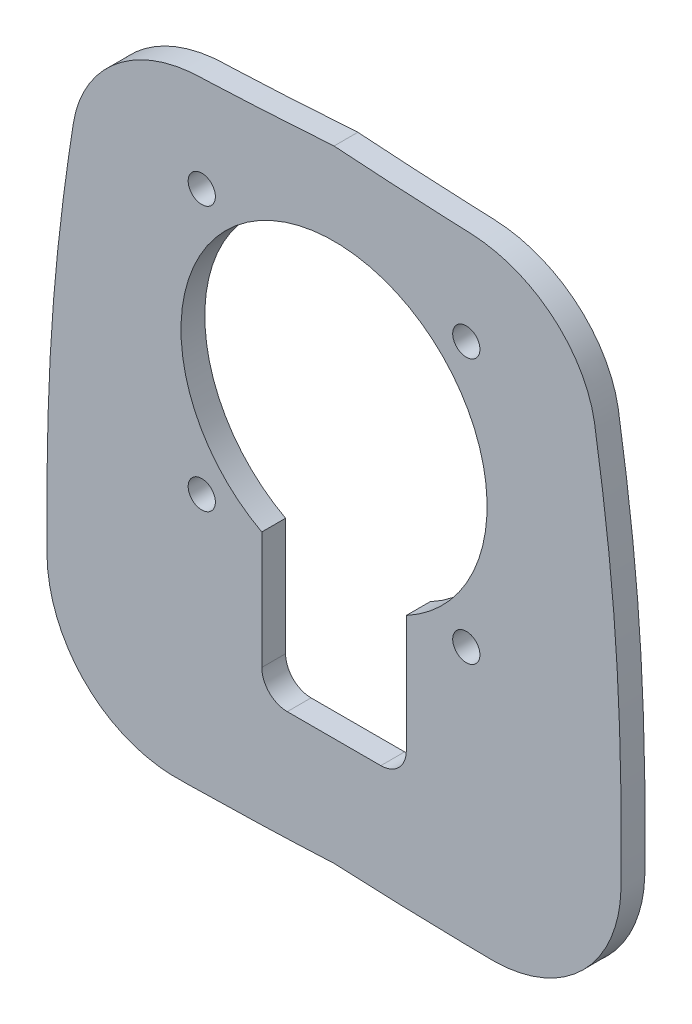
from build123d import *

# Parameters (mm, degrees)
SKETCH_1_R      = 1.6
EXTRUDE_1_DEPTH = 1.4


with BuildPart() as part:
    # Эскиз1 → Бобышка-Вытянуть1 (new, symmetric)
    with BuildSketch(Plane.XY):
        with BuildLine():
            add(Edge.make_bspline(
                [(-1.4518e-05, 131.329874447), (-1.2675789, 131.24206361), (-3.803234632, 131.071000313), (-7.607841607, 130.850178677), (-10.780348303, 130.686157301), (-13.317926497, 130.57318343), (-14.904389447, 130.501671683), (-16.175728377, 130.463940264), (-17.522261276, 130.359007823), (-19.822431484, 129.963798755), (-22.995032999, 128.80880525), (-26.347758133, 126.496619677), (-28.538996839, 123.882075599), (-29.791983056, 121.475659209), (-30.343896353, 119.877882559), (-30.63403442, 118.533439447), (-30.818645771, 117.266173598), (-31.065506467, 115.693383256), (-31.340360963, 113.798909793), (-31.694015499, 111.271367457), (-32.263022369, 106.839432508), (-32.923148473, 100.48741911), (-33.443913942, 92.841153375), (-33.673102835, 86.46289944), (-33.760651088, 81.361670277), (-33.778437773, 78.172262621), (-33.776910965, 75.624966905), (-33.762110975, 74.025025286), (-33.759441619, 72.762103018), (-33.704752274, 71.407863518), (-33.376271412, 69.090221596), (-32.274669819, 65.883099062), (-29.980797778, 62.516063631), (-26.862738782, 59.888354717), (-23.774919099, 58.481134672), (-21.151162291, 57.87239911), (-19.484098936, 57.704487455), (-18.142637171, 57.701888304), (-16.884353961, 57.725286948), (-14.642260059, 57.763239123), (-11.466723608, 57.836609415), (-6.367315938, 57.978415878), (-2.546627078, 58.134956479), (-0.000242534, 58.263149004)],
                knots=[-0.000453625, -0.000453625, -0.000453625, -0.000453625, 0.030800185, 0.062053994, 0.093307803, 0.108934708, 0.124561613, 0.132375065, 0.140188517, 0.155815422, 0.187069231, 0.21832304, 0.24957685, 0.265203754, 0.280830659, 0.288644111, 0.296457564, 0.312084468, 0.327711373, 0.343338278, 0.374592087, 0.437099705, 0.499607324, 0.562114943, 0.593368752, 0.624622561, 0.640249466, 0.655876371, 0.663689823, 0.671503275, 0.68713018, 0.718383989, 0.749637798, 0.780891608, 0.812145417, 0.827772322, 0.843399226, 0.851212679, 0.859026131, 0.874653036, 0.905906845, 0.937160654, 0.999668273, 0.999668273, 0.999668273, 0.999668273], degree=3))
            add(Edge.make_bspline(
                [(-0.000242534, 58.263149004), (2.546410446, 58.133398348), (6.367949075, 57.978640472), (11.46740785, 57.836698075), (14.643987579, 57.762539624), (16.885107326, 57.726366984), (18.145185333, 57.701032579), (19.48463002, 57.705153255), (21.153193314, 57.872577786), (23.777120564, 58.481945578), (26.869668257, 59.892672746), (29.986711756, 62.521939879), (32.278099202, 65.892475088), (33.37703242, 69.08741856), (33.754279242, 71.764671837), (33.761576865, 73.730751918), (33.776263427, 75.627866309), (33.778789625, 78.182992088), (33.760434051, 81.368922861), (33.672944747, 86.472069365), (33.443419366, 92.850056096), (32.922331539, 100.497193063), (32.261924735, 106.849604956), (31.692488477, 111.281956752), (31.339000393, 113.80947484), (31.063741713, 115.704697772), (30.817576456, 117.276143704), (30.631651977, 118.547352175), (30.340756824, 119.888301445), (29.787714698, 121.486256589), (28.532806263, 123.890164463), (26.342977661, 126.500218601), (22.998420382, 128.806954431), (19.823396174, 129.963221763), (17.524944608, 130.359074286), (16.176301063, 130.463473016), (14.904398659, 130.50158566), (13.319508846, 130.573171615), (10.780895349, 130.686119104), (7.608508303, 130.850163366), (3.803552904, 131.070932744), (1.26766937, 131.242101451), (-1.4518e-05, 131.329874447)],
                knots=[0.000331697, 0.000331697, 0.000331697, 0.000331697, 0.062839315, 0.094093124, 0.125346933, 0.140973838, 0.14878729, 0.156600742, 0.172227647, 0.187854551, 0.219108361, 0.25036217, 0.281615979, 0.312869788, 0.328496692, 0.344123597, 0.359750501, 0.375377406, 0.406631215, 0.437885024, 0.500392642, 0.562900261, 0.625407879, 0.656661688, 0.672288592, 0.687915497, 0.703542401, 0.711355854, 0.719169306, 0.73479621, 0.750423115, 0.781676924, 0.812930733, 0.844184542, 0.859811447, 0.867624899, 0.875438351, 0.891065256, 0.90669216, 0.93794597, 0.969199779, 1.000453588, 1.000453588, 1.000453588, 1.000453588], degree=3))
        make_face()
        with Locations((15.556349186, 88.080595835)):
            Circle(SKETCH_1_R, mode=Mode.SUBTRACT)
        with Locations((15.556349186, 119.193294207)):
            Circle(SKETCH_1_R, mode=Mode.SUBTRACT)
        with Locations((-15.55660549, 119.193944659)):
            Circle(SKETCH_1_R, mode=Mode.SUBTRACT)
        with Locations((-15.55660549, 88.079945382)):
            Circle(SKETCH_1_R, mode=Mode.SUBTRACT)
        with BuildLine():
            ThreePointArc((5.5, 70.971304906), (7.621320344, 71.849984563), (8.5, 73.971304906))
            Line((8.5, 73.971304906), (8.5, 87.770313368))
            ThreePointArc((8.5, 87.770313368), (0, 121.636945021), (-8.5, 87.770313368))
            Line((-8.5, 87.770313368), (-8.5, 73.971304906))
            ThreePointArc((-8.5, 73.971304906), (-7.621320344, 71.849984563), (-5.5, 70.971304906))
            Line((-5.5, 70.971304906), (5.5, 70.971304906))
        make_face(mode=Mode.SUBTRACT)
    extrude(amount=EXTRUDE_1_DEPTH, both=True)


solid = part.part
